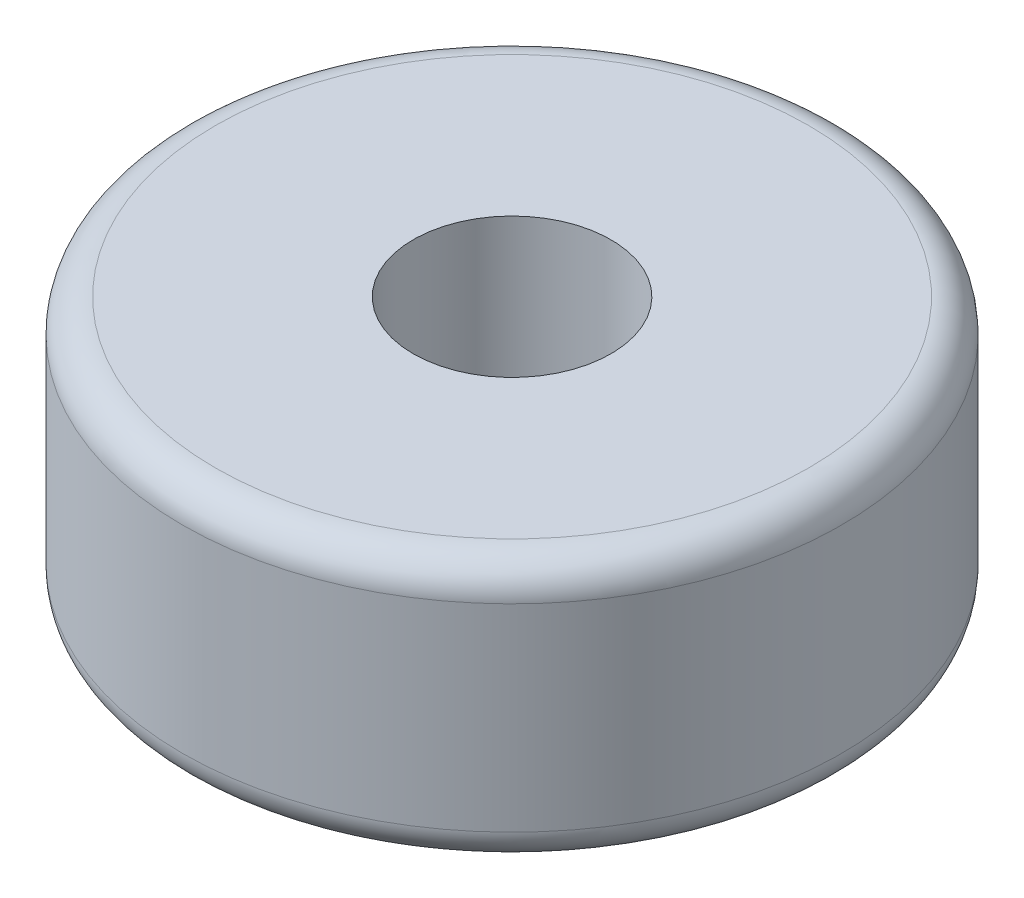
from build123d import *

# Parameters (mm, degrees)
SKETCH1_R           = 10
SKETCH1_R_2         = 3
BOSS_EXTRUDE1_DEPTH = 8
FILLET1_R           = 1


with BuildPart() as part:
    # Sketch1 → Boss-Extrude1 (new body)
    with BuildSketch(Plane(origin=(0, 0, 0), x_dir=(1, 0, 0), z_dir=(0, 1, 0))):
        with Locations(Location((0, 0, 0), (0, 0, 270))):
            Circle(SKETCH1_R)
        with Locations(Location((0, 0, 0), (0, 0, 270))):
            Circle(SKETCH1_R_2, mode=Mode.SUBTRACT)
    extrude(amount=BOSS_EXTRUDE1_DEPTH)

    # Fillet1
    fillet1_edges = [part.edges().sort_by_distance(p)[0] for p in [
        (0, 0, -10),
        (0, 8, -10),
    ]]
    fillet(fillet1_edges, radius=FILLET1_R)


solid = part.part
